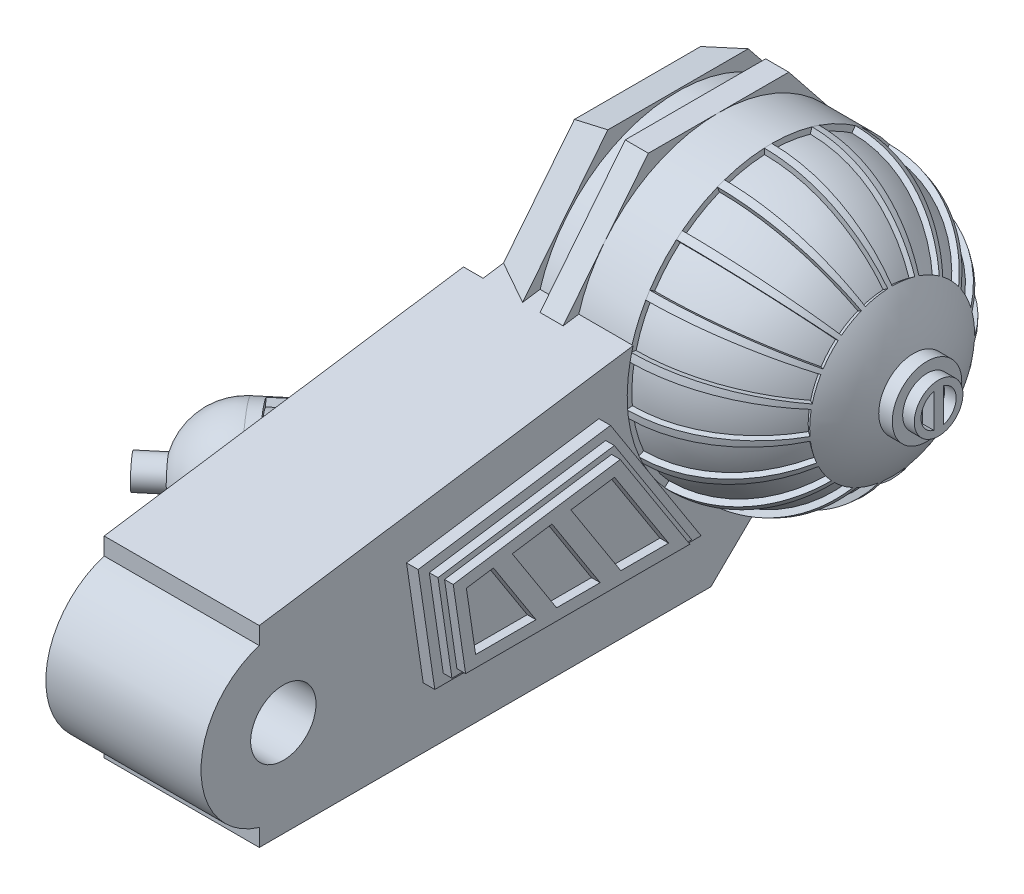
from build123d import *

# Parameters (mm, degrees)
LEGBASE_DEPTH                = 2
SKETCH2_R                    = 12.592046567
BOSS_EXTRUDE2_DEPTH          = 4.6
REVOLVE1_ANGLE               = 180
SKETCH4_R                    = 3
BOSS_EXTRUDE3_DEPTH          = 20
SKETCH5_R                    = 2.1
BOSS_EXTRUDE4_DEPTH          = 1
CUT_EXTRUDE1_DEPTH           = 1
SKETCH8_R                    = 12.443892304
BOSS_EXTRUDE5_DEPTH          = 1.5
BOSS_EXTRUDE6_DEPTH          = 3.5
DRAFT6_ANGLE                 = -20
LOWERTHIGH_DEPTH             = 6.7
LOWERTHIGH_DIRECTION_2_REACH = 30.67
BOSS_EXTRUDE8_DEPTH          = 1
BOSS_EXTRUDE9_DEPTH          = 0.75
BOSS_EXTRUDE10_DEPTH         = 0.75
BOSS_EXTRUDE11_DEPTH         = 1.7
ENDJOINT_DEPTH               = 13.4
SKETCH18_R                   = 2.82047682
CUT_EXTRUDE2_DEPTH           = 55.432097796
BOSS_EXTRUDE13_DEPTH         = 1
SKETCH21_R                   = 4.975138761
BOSS_EXTRUDE14_DEPTH         = 1
BOSS_EXTRUDE15_REACH         = 57.213
SKETCH23_R                   = 4.376771324
BOSS_EXTRUDE16_REACH         = 57.398
CIRPATTERN1_COUNT            = 2
CIRPATTERN1_ANGLE            = 57
CIRPATTERN2_COUNT            = 2
CIRPATTERN2_ANGLE            = 57
SKETCH28_R                   = 1.3
BOSS_EXTRUDE18_DEPTH         = 7
REVOLVE3_ANGLE               = 180
SKETCH30_RX                  = 7.005230131
SKETCH30_RY                  = 5.121616656
BOSS_EXTRUDE19_DEPTH         = 0.5
REVOLVE4_ANGLE               = 3
CIRPATTERN5_COUNT            = 19


with BuildPart() as part:
    # Sketch1 → LegBase (new body)
    with BuildSketch(Plane(origin=(0, 0, 0), x_dir=(0, 0, -1), z_dir=(1, 0, 0))):
        Polygon((6.064010025, 12.592046567), (-6.064010025, 12.592046567), (-13.625706844, 3.109978671), (-10.926968495, -8.713966596), (0, -13.976117284), (10.926968495, -8.713966596), (13.625706844, 3.109978671), align=None)
    extrude(amount=LEGBASE_DEPTH)

    # Sketch2 → Boss-Extrude2 (add)
    with BuildSketch(Plane(origin=(2, 0, 0), x_dir=(0, 0, -1), z_dir=(1, 0, 0))):
        with Locations(Location((0, 0, 0), (0, 0, 192.857142857))):
            Circle(SKETCH2_R)
    extrude(amount=BOSS_EXTRUDE2_DEPTH)

    # Sketch3 → Revolve1 (revolve)
    with BuildSketch(Plane(origin=(6.6, 0, 0), x_dir=(0, 0, -1), z_dir=(1, 0, 0))):
        with BuildLine():
            Line((0, 12.592046567), (0, -12.592046567))
            ThreePointArc((0, -12.592046567), (12.592046567, 0), (0, 12.592046567))
        make_face()
    revolve(axis=Axis((6.6, 12.592046567, 0), (0, -1, 0)), revolution_arc=REVOLVE1_ANGLE)

    # Sketch4 → Boss-Extrude3 (add)
    with BuildSketch(Plane(origin=(0, 0, 0), x_dir=(0, 0, -1), z_dir=(1, 0, 0))):
        Circle(SKETCH4_R)
    extrude(amount=BOSS_EXTRUDE3_DEPTH)

    # Sketch5 → Boss-Extrude4 (add)
    with BuildSketch(Plane(origin=(20, 0, 0), x_dir=(0, 0, -1), z_dir=(1, 0, 0))):
        Circle(SKETCH5_R)
    extrude(amount=BOSS_EXTRUDE4_DEPTH)

    # Sketch6 → Cut-Extrude1 (cut)
    with BuildSketch(Plane(origin=(21, 0, 0), x_dir=(0, 0, -1), z_dir=(1, 0, 0))):
        with BuildLine():
            ThreePointArc((-0.409643232, 1.463224915), (-1.519485021, 0), (-0.409643232, -1.463224915))
            Line((-0.409643232, -1.463224915), (-0.409643232, 1.463224915))
        make_face()
        with BuildLine():
            Line((0.409643232, 1.463224915), (0.409643232, -1.463224915))
            ThreePointArc((0.409643232, -1.463224915), (1.210636503, -0.918255949), (1.519485021, 0))
            ThreePointArc((1.519485021, 0), (1.210636503, 0.918255949), (0.409643232, 1.463224915))
        make_face()
    extrude(amount=-CUT_EXTRUDE1_DEPTH, mode=Mode.SUBTRACT)

    # Sketch8 → Boss-Extrude5 (add)
    with BuildSketch(Plane.ZY):
        with Locations(Location((0, 0, 0), (0, 0, 180))):
            Circle(SKETCH8_R)
    extrude(amount=BOSS_EXTRUDE5_DEPTH)

    # Sketch11 → Boss-Extrude6 (add)
    with BuildSketch(Plane.ZY.offset(1.5)):
        Polygon((-6.064010025, 12.592046567), (-13.625706844, 3.109978671), (-10.926968495, -8.713966596), (0, -13.976117284), (10.926968495, -8.713966596), (13.625706844, 3.109978671), (6.064010025, 12.592046567), align=None)
    extrude(amount=BOSS_EXTRUDE6_DEPTH)

    # Draft6
    draft6_faces = [part.faces().sort_by_distance(p)[0] for p in [
        (-3.25, -2.801993962, 12.276337669),
        (-3.25, 7.851012619, 9.844858435),
        (-3.25, 12.592046567, 0),
        (-3.25, 7.851012619, -9.844858435),
        (-3.25, -2.801993962, -12.276337669),
        (-3.25, -11.34504194, -5.463484247),
        (-3.25, -11.34504194, 5.463484247),
    ]]
    draft(draft6_faces, Plane(origin=(-1.5, 0, 0), x_dir=(0, 0, 1), z_dir=(1, 0, 0)), DRAFT6_ANGLE)

    # Sketch12 → LowerThigh (add)
    with BuildSketch(Plane(origin=(0, 0, 0), x_dir=(0, 0, -1), z_dir=(1, 0, 0))):
        Polygon((0, 0), (0, 5.356334398), (-44.364449127, -1.233485831), (-44.364449127, -17.833485831), (-5.364449127, -17.833485831), (0, -12.592046567), align=None)
    extrude(amount=LOWERTHIGH_DEPTH)

    # LowerThigh direction 2: up to this face of the body (flat: up to its plane)
    lowerthigh_direction_2_end = Plane(part.part.faces().sort_by_distance((-5, 0, 0))[0])
    # Sketch12 → LowerThigh direction 2 (add, up to the picked face)
    with BuildSketch(Plane(origin=(0, 0, 0), x_dir=(0, 0, -1), z_dir=(1, 0, 0)), mode=Mode.PRIVATE) as lowerthigh_direction_2_sk1:
        Polygon((0, 0), (0, 5.356334398), (-44.364449127, -1.233485831), (-44.364449127, -17.833485831), (-5.364449127, -17.833485831), (0, -12.592046567), align=None)
    lowerthigh_direction_2_tool1 = split(extrude(lowerthigh_direction_2_sk1.sketch, amount=-LOWERTHIGH_DIRECTION_2_REACH, mode=Mode.PRIVATE), bisect_by=lowerthigh_direction_2_end, keep=Keep.BOTH, mode=Mode.PRIVATE)
    add(lowerthigh_direction_2_tool1.solids().sort_by(Axis((0, -7.66088, 21.267929), (-1, 0, 0)))[0])

    # Sketch13 → Boss-Extrude8 (add)
    with BuildSketch(Plane(origin=(6.7, 0, 0), x_dir=(0, 0, -1), z_dir=(1, 0, 0))):
        Polygon((-31.650721497, -2.898401616), (-15.033044439, -0.430039975), (-7.210843873, -12.592046567), (-30.210843873, -12.592046567), align=None)
    extrude(amount=BOSS_EXTRUDE8_DEPTH)

    # Sketch14 → Boss-Extrude9 (add)
    with BuildSketch(Plane(origin=(7.7, 0, 0), x_dir=(0, 0, -1), z_dir=(1, 0, 0))):
        Polygon((-30.685058825, -3.614289598), (-29.477775553, -11.742046567), (-8.768165295, -11.742046567), (-15.451049847, -1.351455674), align=None)
    extrude(amount=BOSS_EXTRUDE9_DEPTH)

    # Sketch15 → Boss-Extrude10 (add)
    with BuildSketch(Plane(origin=(8.45, 0, 0), x_dir=(0, 0, -1), z_dir=(1, 0, 0))):
        Polygon((-15.69693538, -1.893464908), (-30.117021959, -4.035400176), (-29.046558894, -11.242046567), (-9.68423672, -11.242046567), align=None)
        Polygon((-26.646449455, -4.530858833), (-28.980948227, -4.877621332), (-28.184125576, -10.242046567), (-22.973202316, -10.242046567), align=None, mode=Mode.SUBTRACT)
        Polygon((-21.583910048, -3.778877793), (-25.017847633, -4.288949074), (-21.189012134, -10.242046567), (-17.427013565, -10.242046567), align=None, mode=Mode.SUBTRACT)
        Polygon((-15.642823382, -10.242046567), (-11.51637957, -10.242046567), (-16.188706448, -2.977483377), (-19.955308226, -3.536968034), align=None, mode=Mode.SUBTRACT)
    extrude(amount=BOSS_EXTRUDE10_DEPTH)

    # Sketch16 → Boss-Extrude11 (add)
    with BuildSketch(Plane.ZY.offset(5)):
        Polygon((13.334569403, 3.375640015), (1.109131949, -13.675745491), (5.364449127, -17.833485831), (44.364449127, -17.833485831), (44.364449127, -1.233485831), align=None)
    extrude(amount=BOSS_EXTRUDE11_DEPTH)

    # Sketch17 → EndJoint (add)
    with BuildSketch(Plane(origin=(6.7, 0, 0), x_dir=(0, 0, -1), z_dir=(1, 0, 0))):
        with BuildLine():
            Line((-44.364449127, -2.733485831), (-44.364449127, -16.333485831))
            ThreePointArc((-44.364449127, -16.333485831), (-49.399696898, -9.533485831), (-44.364449127, -2.733485831))
        make_face()
    extrude(amount=-ENDJOINT_DEPTH)

    # Sketch18 → Cut-Extrude2 (cut, through all)
    with BuildSketch(Plane(origin=(6.7, 0, 0), x_dir=(0, 0, -1), z_dir=(1, 0, 0))):
        with Locations((-42.290441964, -9.533485831)):
            Circle(SKETCH18_R)
    extrude(amount=-CUT_EXTRUDE2_DEPTH, mode=Mode.SUBTRACT)

    # Sketch19 → Boss-Extrude13 (add)
    with BuildSketch(Plane.ZY.offset(6.7)):
        Polygon((7.800678698, -12.065601926), (9.098318214, -13.333485831), (36.325372453, -13.333485831), (36.325372453, -4.588747299), (15.39089451, -1.479175356), align=None)
    extrude(amount=BOSS_EXTRUDE13_DEPTH)

    # Sketch23 → Boss-Extrude15 (add, up to next)
    with BuildSketch(Plane(origin=(-19.450876437, 0, 16.321223244), x_dir=(-0.6427876096865351, 0, -0.7660444431189817), z_dir=(0.7660444431189816, 0, -0.642787609686535)), mode=Mode.PRIVATE) as boss_extrude15_sk1:
        with Locations(Location((-12.950151977, -8.155577983, 0), (0, 0, 180))):
            Circle(SKETCH23_R)
    boss_extrude15_tool1 = extrude(boss_extrude15_sk1.sketch, amount=BOSS_EXTRUDE15_REACH, mode=Mode.PRIVATE) - part.part


with BuildPart() as body_2:
    # Sketch21 → Boss-Extrude14 (new body)
    with BuildSketch(Plane(origin=(-19.450876437, 0, 16.321223244), x_dir=(0, -1, 0), z_dir=(0.7660444431189817, 0, -0.642787609686535))):
        with Locations(Location((8.155577983, -12.950151977, 0), (0, 0, 90))):
            Circle(SKETCH21_R)
    extrude(amount=-BOSS_EXTRUDE14_DEPTH)


with BuildPart() as part_1:
    add(part.part)

    add(body_2.part)  # Boss-Extrude15 merges body 2
    add(boss_extrude15_tool1.solids().sort_by_distance((-11.126679, -8.155578, 26.241615))[0])

    # Boss-Extrude16: up to this plane
    boss_extrude16_end = Plane(origin=(-7.7, 0, 0), z_dir=(-1, 0, 0))
    # Sketch24 → Boss-Extrude16 (add, up to the surface)
    with BuildSketch(Plane(origin=(-20.21692088, 0, 16.964010854), x_dir=(0.6427876096865351, 0, 0.7660444431189817), z_dir=(-0.7660444431189816, 0, 0.642787609686535)), mode=Mode.PRIVATE) as boss_extrude16_sk1:
        with BuildLine():
            Line((12.950151977, -8.155577983), (8.002457909, -8.677429594))
            ThreePointArc((8.002457909, -8.677429594), (7.975013216, -8.155577983), (8.002457909, -7.633726372))
            Line((8.002457909, -7.633726372), (12.950151977, -8.155577983))
        make_face()
    boss_extrude16_tool1 = split(extrude(boss_extrude16_sk1.sketch, amount=-BOSS_EXTRUDE16_REACH, mode=Mode.PRIVATE), bisect_by=boss_extrude16_end, keep=Keep.BOTH, mode=Mode.PRIVATE)
    boss_extrude16 = boss_extrude16_tool1.solids().sort_by_distance((-14.020774, -8.155578, 24.348292))[0]
    add(boss_extrude16)

    # CirPattern1: Boss-Extrude16 ×2 about axis
    cirpattern1_axis = Axis((8.324197234, -8.155577983, 9.920391959), (-0.7660444431189818, 0, 0.642787609686535))
    for i in range(1, CIRPATTERN1_COUNT):
        add(boss_extrude16.rotate(cirpattern1_axis, i * CIRPATTERN1_ANGLE / (CIRPATTERN1_COUNT - 1)))

    # CirPattern2: Boss-Extrude16 ×2 about axis
    cirpattern2_axis = Axis((8.324197234, -8.155577983, 9.920391959), (0.7660444431189815, 0, -0.6427876096865353))
    for i in range(1, CIRPATTERN2_COUNT):
        add(boss_extrude16.rotate(cirpattern2_axis, i * CIRPATTERN2_ANGLE / (CIRPATTERN2_COUNT - 1)))

    # Sketch28 → Boss-Extrude18 (add)
    with BuildSketch(Plane(origin=(-20.21692088, 0, 16.964010854), x_dir=(0.6427876096865351, 0, 0.7660444431189817), z_dir=(-0.7660444431189816, 0, 0.642787609686535))):
        with Locations(Location((12.950151977, -8.155577983, 0), (0, 0, 180))):
            Circle(SKETCH28_R)
    extrude(amount=BOSS_EXTRUDE18_DEPTH)

    # Sketch29 → Revolve3 (revolve)
    with BuildSketch(Plane(origin=(-20.21692088, 0, 16.964010854), x_dir=(0.6427876096865351, 0, 0.7660444431189817), z_dir=(-0.7660444431189816, 0, 0.642787609686535))):
        with BuildLine():
            Line((12.950151977, -3.180439222), (12.950151977, -13.130716744))
            ThreePointArc((12.950151977, -13.130716744), (17.925290737, -8.155577983), (12.950151977, -3.180439222))
        make_face()
    revolve(axis=Axis((-11.892723646, -3.180439222, 26.884402813), (0, -1, 0)), revolution_arc=REVOLVE3_ANGLE)

    # Sketch30 → Boss-Extrude19 (add)
    with BuildSketch(Plane.ZY.offset(7.7)):
        with Locations(Location((23.876937675, -8.155577983), (0, 0, -180))):
            Ellipse(SKETCH30_RX, SKETCH30_RY)
    extrude(amount=BOSS_EXTRUDE19_DEPTH)

    # Sketch32 → Cut-Revolve1 (revolve, cut)
    with BuildSketch(Plane.XY, mode=Mode.PRIVATE) as cut_revolve1_sk:
        with BuildLine():
            Line((16.986121539, 7.119558702), (16.573713537, 6.836858083))
            ThreePointArc((16.573713537, 6.836858083), (12.236753669, 10.697878212), (6.6, 12.092046567))
            Line((6.6, 12.092046567), (6.6, 12.592046567))
            ThreePointArc((6.6, 12.592046567), (12.469830578, 11.140230057), (16.986121539, 7.119558702))
        make_face()
    revolve(cut_revolve1_sk.sketch.rotate(Axis((0, 0, 0), (1, 0, 0)), 90), axis=Axis((0, 0, 0), (1, 0, 0)), mode=Mode.SUBTRACT)

    # Sketch34 → Revolve4 (revolve)
    with BuildSketch(Plane.XY):
        with BuildLine():
            Line((6.6, 12.592046567), (6.6, 12.092046567))
            ThreePointArc((6.6, 12.092046567), (12.236753669, 10.697878212), (16.573713537, 6.836858083))
            Line((16.573713537, 6.836858083), (16.986121539, 7.119558702))
            ThreePointArc((16.986121539, 7.119558702), (12.469830578, 11.140230057), (6.6, 12.592046567))
        make_face()
    revolve4 = revolve(axis=Axis((0, 0, 0), (1, 0, 0)), revolution_arc=REVOLVE4_ANGLE)

    # CirPattern5: Revolve4 ×19 about axis
    cirpattern5_axis = Axis((0, 0, 0), (1, 0, 0))
    for i in range(1, CIRPATTERN5_COUNT):
        add(revolve4.rotate(cirpattern5_axis, i * 360 / CIRPATTERN5_COUNT))


solid = part_1.part
